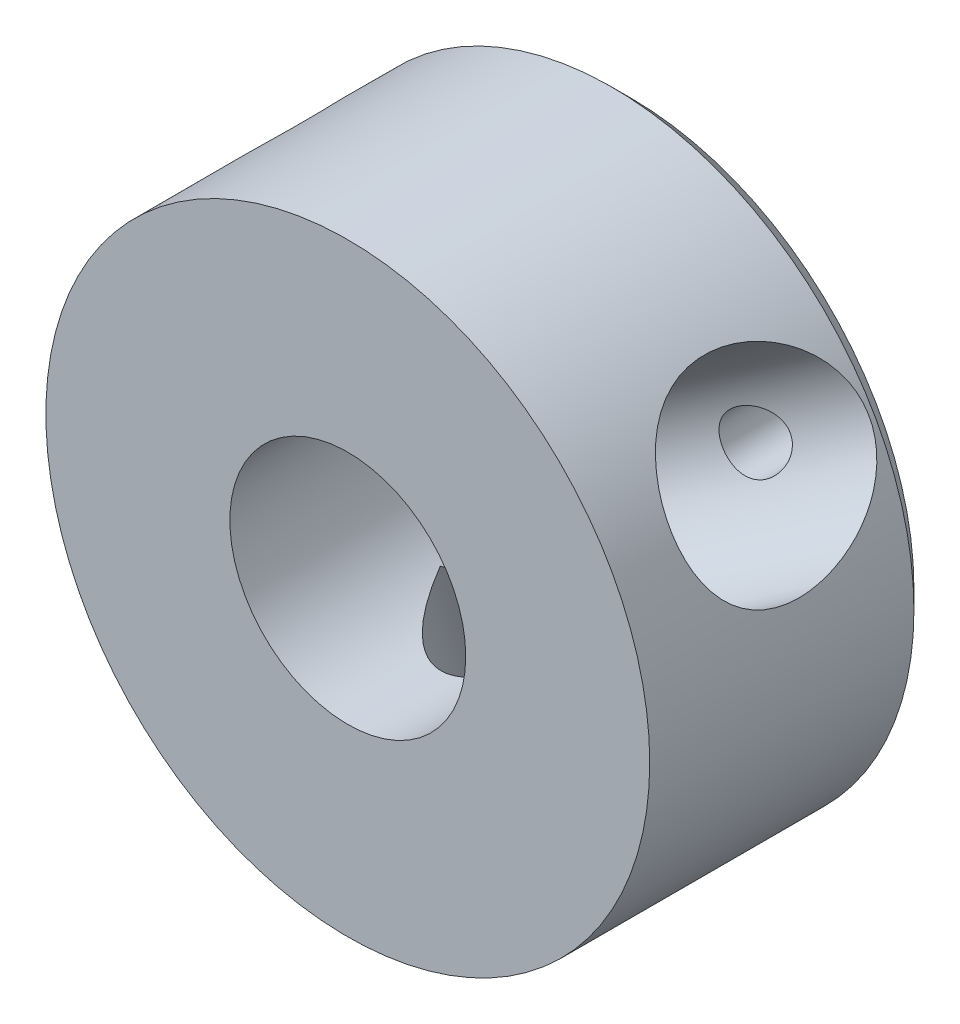
from build123d import *

# Parameters (mm, degrees)
SKETCH1_R           = 32
SKETCH1_R_2         = 12.5
BOSS_EXTRUDE1_DEPTH = 15
SKETCH2_R           = 10
CUT_EXTRUDE1_DEPTH  = 56.689497751
CIRPATTERN1_COUNT   = 3
SKETCH4_R           = 3
CUT_EXTRUDE3_DEPTH  = 11
CIRPATTERN2_COUNT   = 3
CHAMFER2_SIZE       = 2


with BuildPart() as part:
    # Sketch1 → Boss-Extrude1 (new, symmetric)
    with BuildSketch(Plane.XY):
        Circle(SKETCH1_R)
        Circle(SKETCH1_R_2, mode=Mode.SUBTRACT)
    extrude(amount=BOSS_EXTRUDE1_DEPTH, both=True)

    # Sketch2 → Cut-Extrude1 (cut, through all)
    with BuildSketch(Plane(origin=(0, -9.819536819, -3.123093004), x_dir=(1, 0, 0), z_dir=(0, 0.9510565162951555, 0.3090169943749417))):
        with Locations(Location((0, -7.935834199, 0), (0, 0, 270))):
            Circle(SKETCH2_R)
    cut_extrude1 = extrude(amount=-CUT_EXTRUDE1_DEPTH, mode=Mode.SUBTRACT)

    # CirPattern1: Cut-Extrude1 ×3 about axis
    cirpattern1_axis = Axis((0, 0, 0), (0, 0, 1))
    for i in range(1, CIRPATTERN1_COUNT):
        add(cut_extrude1.rotate(cirpattern1_axis, i * 360 / CIRPATTERN1_COUNT), mode=Mode.SUBTRACT)

    # Sketch4 → Cut-Extrude3 (cut)
    with BuildSketch(Plane.XY.offset(-15)):
        with Locations(Location((0, -22, 0), (0, 0, 180))):
            Circle(SKETCH4_R)
    cut_extrude3 = extrude(amount=CUT_EXTRUDE3_DEPTH, mode=Mode.SUBTRACT)

    # CirPattern2: Cut-Extrude3 ×3 about axis
    cirpattern2_axis = Axis((0, 0, 0), (0, 0, 1))
    for i in range(1, CIRPATTERN2_COUNT):
        add(cut_extrude3.rotate(cirpattern2_axis, i * 360 / CIRPATTERN2_COUNT), mode=Mode.SUBTRACT)

    # Chamfer2
    chamfer2_edges = [part.edges().sort_by_distance(p)[0] for p in [
        (-32, 0, -15),
    ]]
    chamfer(chamfer2_edges, length=CHAMFER2_SIZE)


solid = part.part
